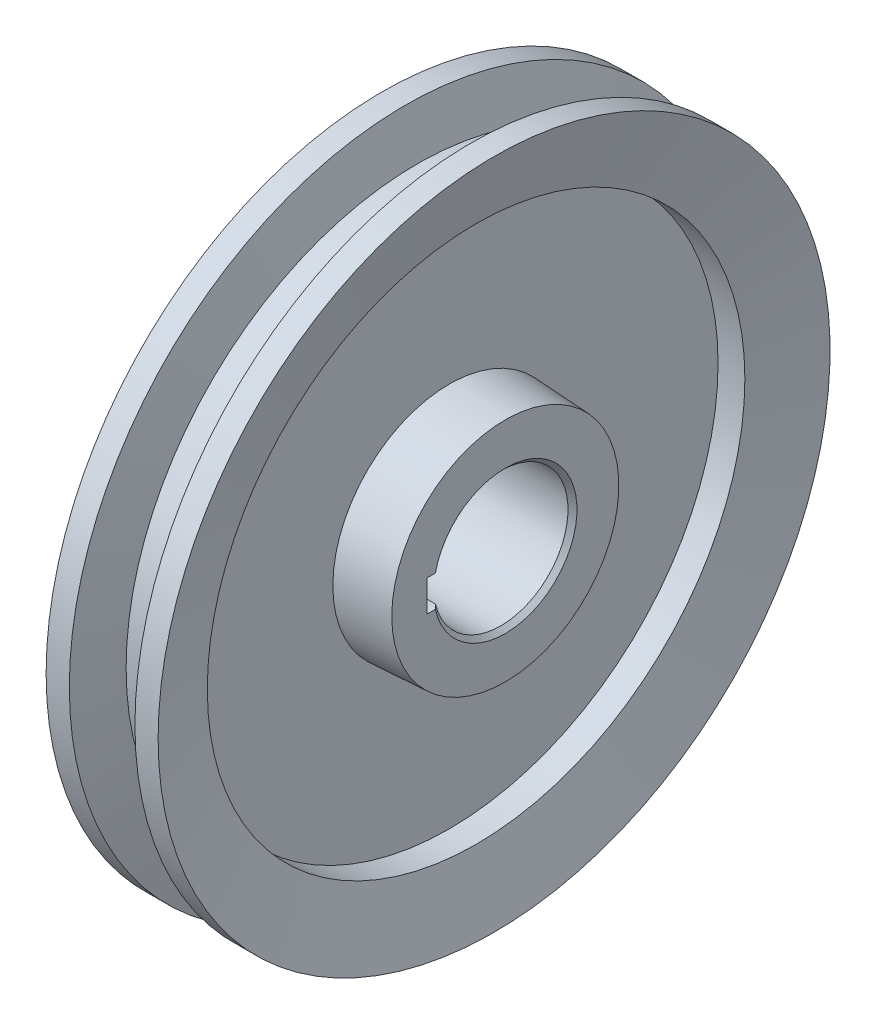
from build123d import *

# Parameters (mm, degrees)
CUT_EXTRUDE1_DEPTH = 30
CHAMFER1_SIZE      = 1
CHAMFER2_SIZE      = 1


with BuildPart() as part:
    # Sketch1 → Revolve1 (revolve)
    with BuildSketch(Plane.XY, mode=Mode.PRIVATE) as revolve1_sk:
        Polygon((15, 15), (15, 25.344902759), (2.5, 26), (2.5, 60), (8.480762114, 60), (12.5, 75), (7.323619098, 75), (4.644127174, 65), (-4.644127174, 65), (-7.323619098, 75), (-12.5, 75), (-8.480762114, 60), (-2.5, 60), (-2.5, 26), (-15, 25.344902759), (-15, 15), align=None)
    revolve(revolve1_sk.sketch.rotate(Axis((0, 0, 0), (1, 0, 0)), 90), axis=Axis((0, 0, 0), (1, 0, 0)))

    # Sketch2 → Cut-Extrude1 (cut)
    with BuildSketch(Plane(origin=(15, 0, 0), x_dir=(0, 0, -1), z_dir=(1, 0, 0))):
        with BuildLine():
            Line((-14.585952146, 3.5), (-17.5, 3.5))
            Line((-17.5, 3.5), (-17.5, -3.5))
            Line((-17.5, -3.5), (-14.585952146, -3.5))
            ThreePointArc((-14.585952146, -3.5), (15, 0), (-14.585952146, 3.5))
        make_face()
    extrude(amount=-CUT_EXTRUDE1_DEPTH, mode=Mode.SUBTRACT)

    # Chamfer1
    chamfer1_edges = [part.edges().sort_by_distance(p)[0] for p in [
        (15, 0, -15),
    ]]
    chamfer(chamfer1_edges, length=CHAMFER1_SIZE)

    # Chamfer2
    chamfer2_edges = [part.edges().sort_by_distance(p)[0] for p in [
        (-15, 0, -15),
    ]]
    chamfer(chamfer2_edges, length=CHAMFER2_SIZE)


solid = part.part
